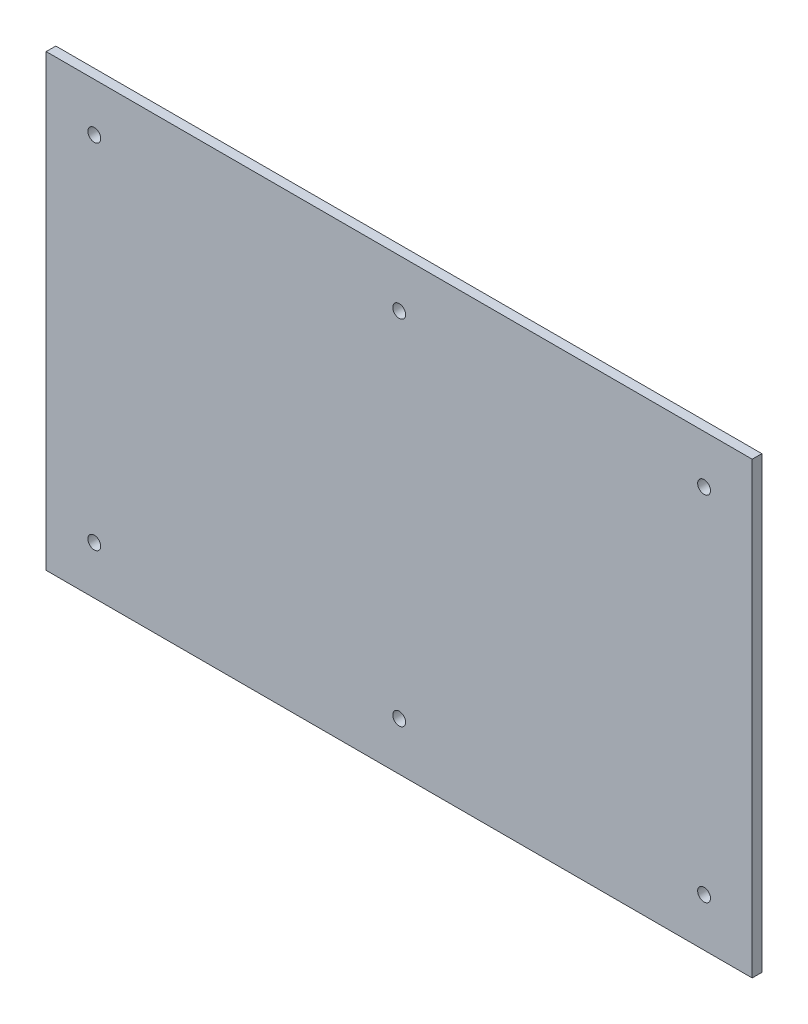
from build123d import *

# Parameters (mm, degrees)
IZIM1_W                     = 220
IZIM1_H                     = 140
Y_KSEKLIK_EKSTR_ZYON1_DEPTH = 3
IZIM2_R                     = 2
KES_EKSTR_ZYON1_DEPTH       = 3


with BuildPart() as part:
    # Çizim1 → Yükseklik-Ekstrüzyon1 (new body)
    with BuildSketch(Plane.XY):
        with Locations((110, 70)):
            Rectangle(IZIM1_W, IZIM1_H)
    extrude(amount=Y_KSEKLIK_EKSTR_ZYON1_DEPTH)

    # Çizim2 → Kes-Ekstrüzyon1 (cut)
    with BuildSketch(Plane.XY.offset(3)):
        with Locations((15, 125)):
            Circle(IZIM2_R)
        with Locations((205, 125)):
            Circle(IZIM2_R)
        with Locations((110, 125)):
            Circle(IZIM2_R)
        with Locations(Location((205, 15, 0), (0, 0, 180))):
            Circle(IZIM2_R)
        with Locations(Location((110, 15, 0), (0, 0, 180))):
            Circle(IZIM2_R)
        with Locations(Location((15, 15, 0), (0, 0, 180))):
            Circle(IZIM2_R)
    extrude(amount=-KES_EKSTR_ZYON1_DEPTH, mode=Mode.SUBTRACT)


solid = part.part
